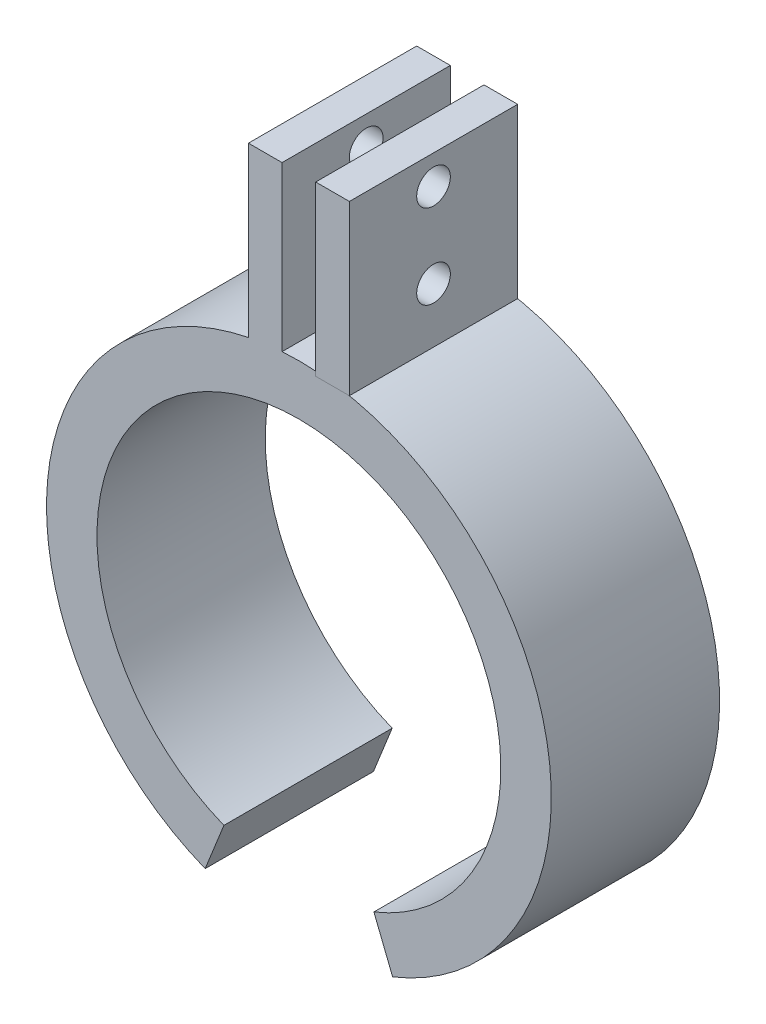
from build123d import *

# Parameters (mm, degrees)
EXTRUDE_THIN1_DEPTH     = 10
SKETCH3_W               = 2
SKETCH3_H               = 10
EXTRUDE_THIN2_DEPTH     = 10
SKETCH4_W               = 2
SKETCH4_H               = 10
EXTRUDE_THIN3_DEPTH     = 10
CUT_EXTRUDE1_DEPTH      = 33.154918273
CUT_EXTRUDE1_DEPTH_BACK = 33.154918273
SKETCH5_R               = 1


with BuildPart() as part:
    # Sketch1 → Extrude-Thin1 (new body)
    with BuildSketch(Plane.XY):
        with BuildLine():
            ThreePointArc((4.456688116, -11.141720291), (0, 12), (-4.456688116, -11.141720291))
            Line((-4.456688116, -11.141720291), (-5.570860145, -13.927150363))
            ThreePointArc((-5.570860145, -13.927150363), (0, 15), (5.570860145, -13.927150363))
            Line((5.570860145, -13.927150363), (4.456688116, -11.141720291))
        make_face()
    extrude(amount=EXTRUDE_THIN1_DEPTH)

    # Sketch3 → Extrude-Thin2 (add)
    with BuildSketch(Plane.XY.offset(10)):
        with Locations((-2, 19.696938457)):
            Rectangle(SKETCH3_W, SKETCH3_H)
    extrude(amount=-EXTRUDE_THIN2_DEPTH)


with BuildPart() as body_2:
    # Sketch4 → Extrude-Thin3 (new body)
    with BuildSketch(Plane.XY):
        with Locations((2, 19.696938457)):
            Rectangle(SKETCH4_W, SKETCH4_H)
    extrude(amount=EXTRUDE_THIN3_DEPTH)


with BuildPart() as cut_extrude1_tool:
    # Sketch5 → Cut-Extrude1 (new, two sides: drawn at the far end of the back side and taken through both)
    with BuildSketch(Plane.ZY.offset(3).offset(-CUT_EXTRUDE1_DEPTH_BACK)):
        with Locations((5, 22.966629547)):
            Circle(SKETCH5_R)
        with Locations((5, 17.966629547)):
            Circle(SKETCH5_R)
    extrude(amount=CUT_EXTRUDE1_DEPTH + CUT_EXTRUDE1_DEPTH_BACK)


with BuildPart() as part_1:
    add(part.part)

    # Cut-Extrude1: cut by cut_extrude1_tool
    add(cut_extrude1_tool.part, mode=Mode.SUBTRACT)


with BuildPart() as body_2_1:
    add(body_2.part)

    # Cut-Extrude1: cut by cut_extrude1_tool
    add(cut_extrude1_tool.part, mode=Mode.SUBTRACT)


solid = Compound([part_1.part, body_2_1.part])
